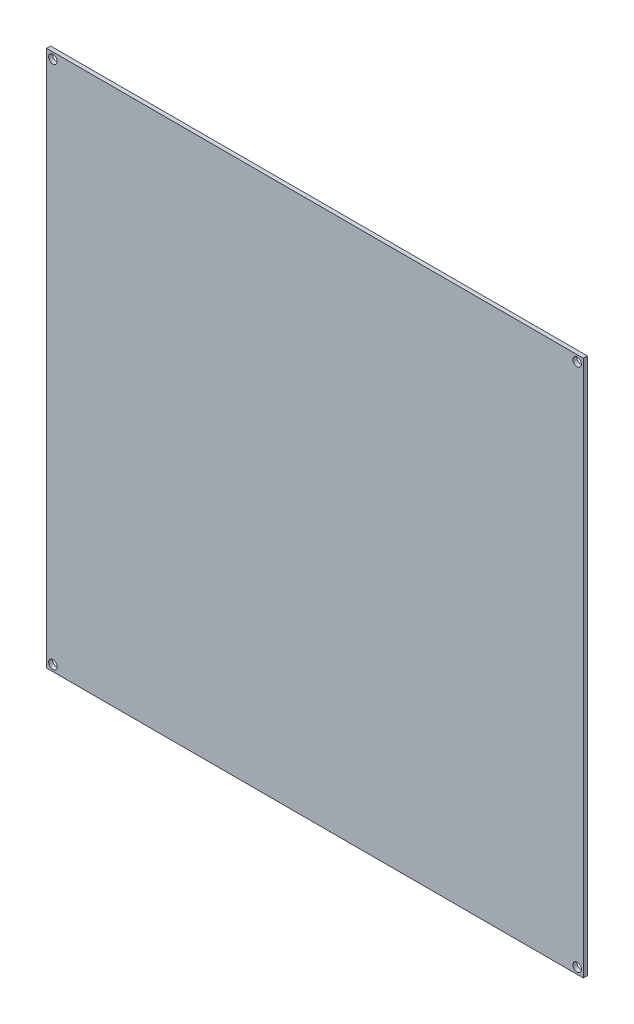
from build123d import *

# Parameters (mm, degrees)
SKETCH1_W           = 214
SKETCH1_H           = 214
BOSS_EXTRUDE1_DEPTH = 1.600000024
SKETCH2_R           = 1.7
CUT_EXTRUDE1_DEPTH  = 275.365741302


with BuildPart() as part:
    # Sketch1 → Boss-Extrude1 (new body)
    with BuildSketch(Plane(origin=(0, 0, -0.800000012), x_dir=(-1, 0, 0), z_dir=(0, 0, -1))):
        with Locations((-50, 118)):
            Rectangle(SKETCH1_W, SKETCH1_H)
    extrude(amount=-BOSS_EXTRUDE1_DEPTH)

    # Sketch2 → Cut-Extrude1 (cut, through all)
    with BuildSketch(Plane.XY.offset(0.800000012)):
        with Locations((154.500001333, 13.5)):
            Circle(SKETCH2_R)
        with Locations((-54.499998667, 222.5)):
            Circle(SKETCH2_R)
        with Locations((154.500001333, 222.5)):
            Circle(SKETCH2_R)
        with Locations((-54.499998667, 13.5)):
            Circle(SKETCH2_R)
    extrude(amount=-CUT_EXTRUDE1_DEPTH, mode=Mode.SUBTRACT)


solid = part.part
